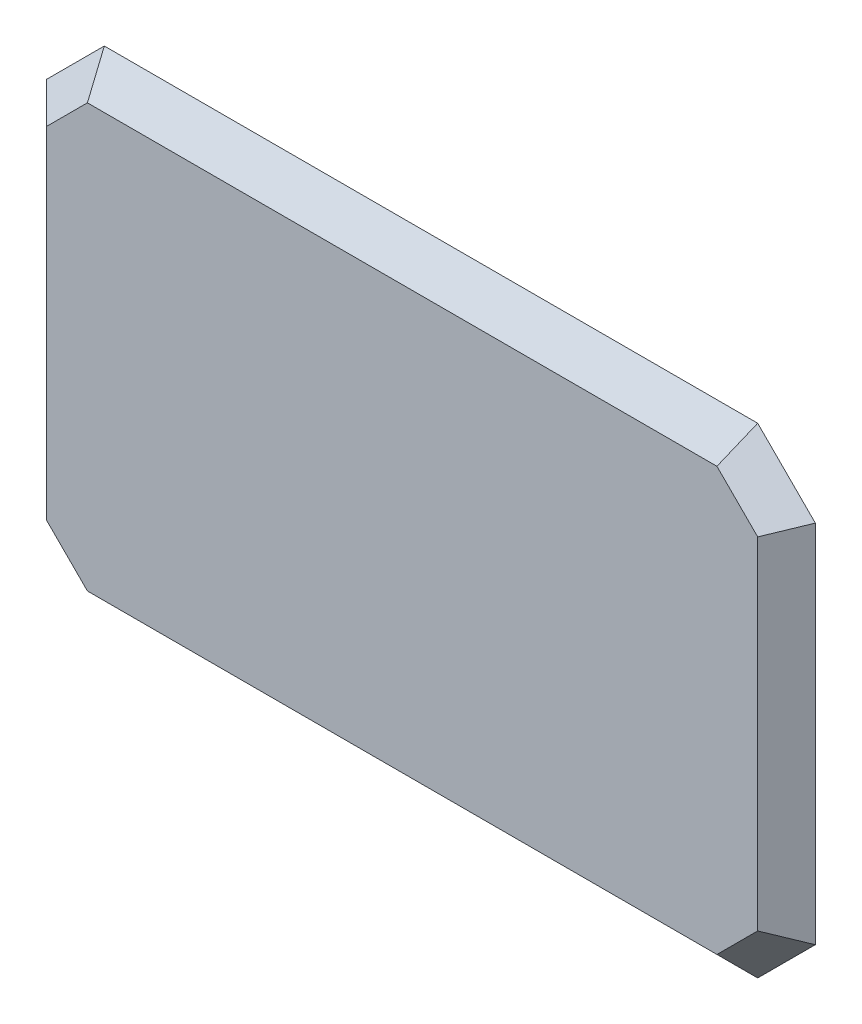
from build123d import *

# Parameters (mm, degrees)
SLOPED_45DEG_ROOF_FLAT_WEBCAM_TOP_DEPTH = 6
SLOPED_45DEG_ROOF_FLAT_WEBCAM_TOP_TAPER = 45


with BuildPart() as part:
    # Sketch1 → Sloped_45deg_Roof_Flat_Webcam_Top (new body)
    with BuildSketch(Plane.XY):
        Polygon((-78, -50), (58, -50), (70, -38), (70, 38), (58, 50), (-78, 50), (-90, 38), (-90, -38), align=None)
    extrude(amount=SLOPED_45DEG_ROOF_FLAT_WEBCAM_TOP_DEPTH, taper=SLOPED_45DEG_ROOF_FLAT_WEBCAM_TOP_TAPER)


solid = part.part
